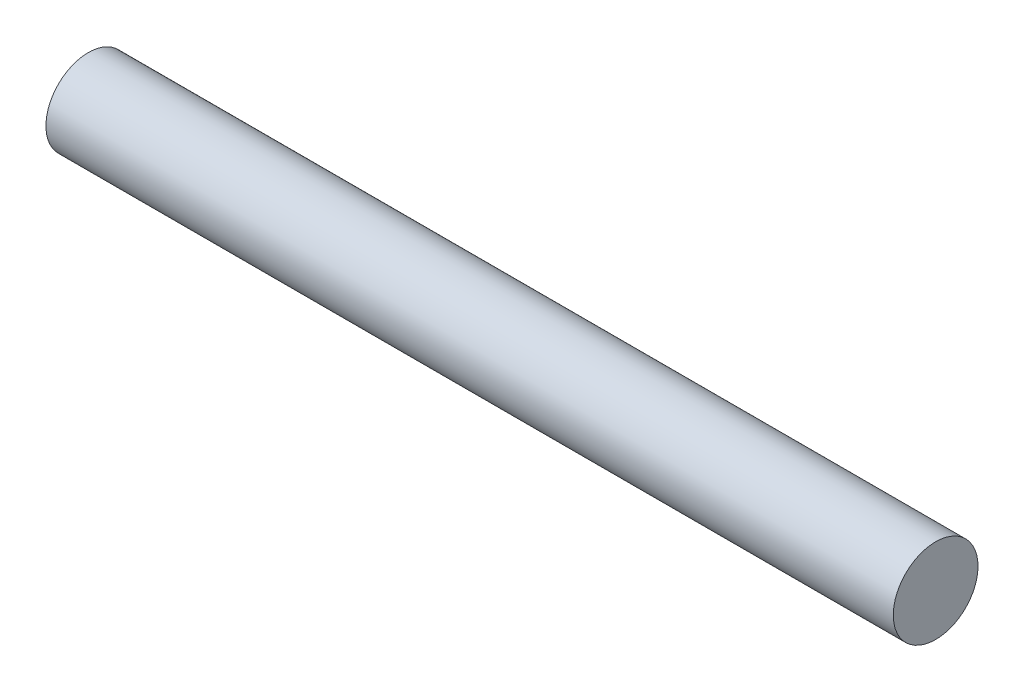
from build123d import *

# Parameters (mm, degrees)
SKETCH1_R           = 1.5
BOSS_EXTRUDE1_DEPTH = 30


with BuildPart() as part:
    # Sketch1 → Boss-Extrude1 (new body)
    with BuildSketch(Plane(origin=(0, 0, 0), x_dir=(0, 0, -1), z_dir=(1, 0, 0))):
        Circle(SKETCH1_R)
    extrude(amount=BOSS_EXTRUDE1_DEPTH)


solid = part.part
